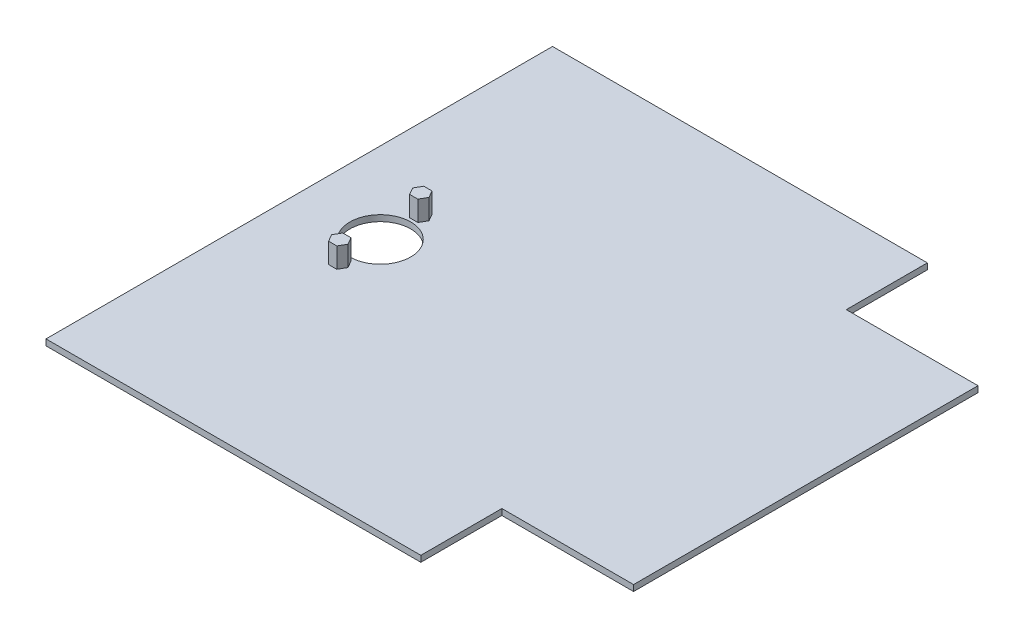
from build123d import *

# Parameters (mm, degrees)
SKETCH1_R           = 15
BOSS_EXTRUDE2_DEPTH = 3
BOSS_EXTRUDE3_DEPTH = 10


with BuildPart() as part:
    # Sketch1 → Boss-Extrude2 (new body)
    with BuildSketch(Plane(origin=(0, 0, 0), x_dir=(1, 0, 0), z_dir=(0, 1, 0))):
        Polygon((0, 0), (185, 0), (185, 40), (250, 40), (250, 210), (185, 210), (185, 250), (0, 250), align=None)
        with Locations(Location((40, 125, 0), (0, 0, 270))):
            Circle(SKETCH1_R, mode=Mode.SUBTRACT)
    extrude(amount=BOSS_EXTRUDE2_DEPTH)

    # Sketch2 → Boss-Extrude3 (add)
    with BuildSketch(Plane(origin=(0, 3, 0), x_dir=(1, 0, 0), z_dir=(0, 1, 0))):
        Polygon((44.041451884, 145), (42.020725942, 148.5), (37.979274058, 148.5), (35.958548116, 145), (37.979274058, 141.5), (42.020725942, 141.5), align=None)
        Polygon((44.041451884, 105), (42.020725942, 108.5), (37.979274058, 108.5), (35.958548116, 105), (37.979274058, 101.5), (42.020725942, 101.5), align=None)
    extrude(amount=BOSS_EXTRUDE3_DEPTH)


solid = part.part
